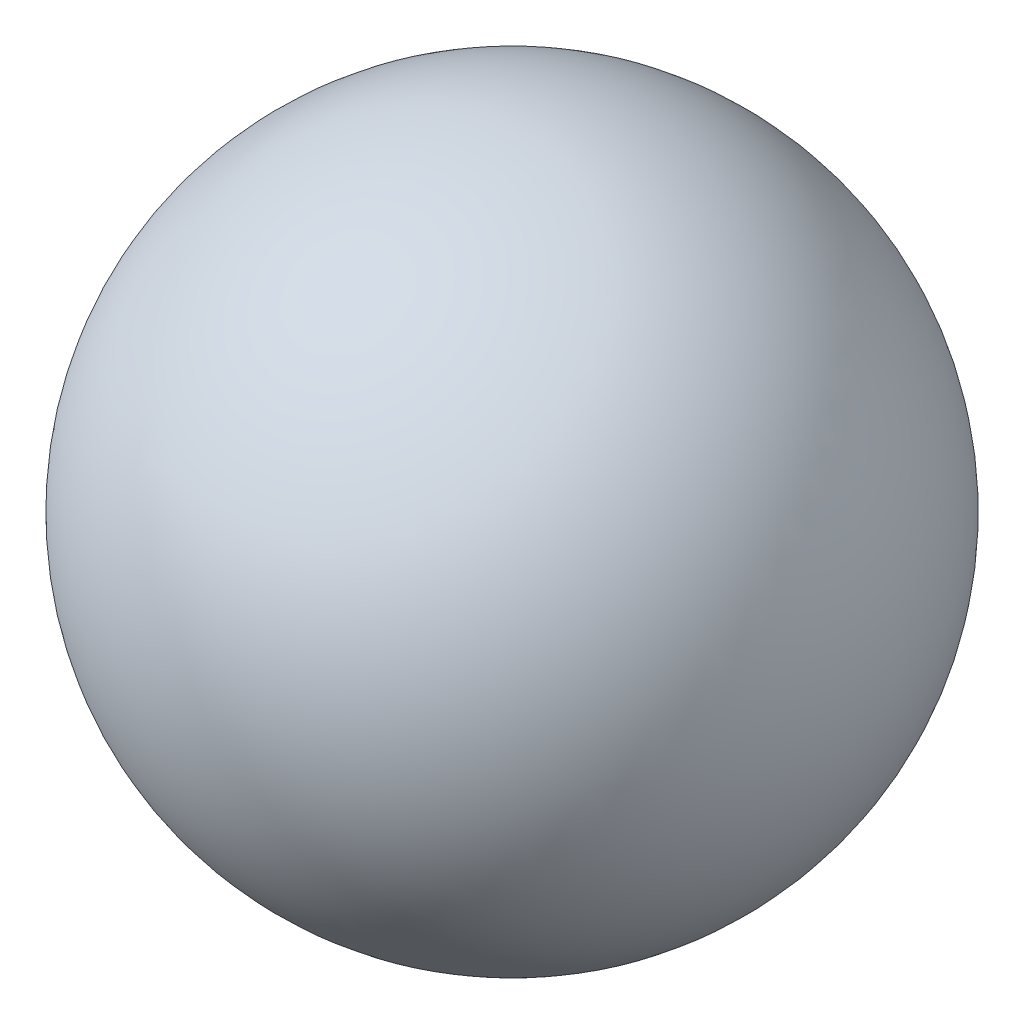
from build123d import *

# Parameters (mm, degrees)
SKETCH1_R                = 0.508
SKETCH1_R_2              = 0.381
BOSS_EXTRUDE1_DEPTH      = 0.127
SKETCH1_4_R              = 0.669887952
BOSS_EXTRUDE3_DEPTH      = 2.54
BOSS_EXTRUDE4_DEPTH      = 2.54
BOSS_EXTRUDE4_DEPTH_BACK = 2.54
SKETCH2_R                = 1.016
SKETCH2_R_2              = 0.508
CUT_EXTRUDE6_START       = 0.5334
SKETCH1_9_R              = 0.381
CUT_EXTRUDE6_DEPTH       = 2.54
SKETCH1_12_R             = 0.381
CUT_EXTRUDE8_DEPTH       = 2.032


with BuildPart() as part:
    # Sketch1 → Boss-Extrude1 (new body)
    with BuildSketch(Plane.XY):
        Circle(SKETCH1_R)
        Circle(SKETCH1_R_2, mode=Mode.SUBTRACT)
    extrude(amount=BOSS_EXTRUDE1_DEPTH)

    # Sketch1<4> → Boss-Extrude3 (add)
    with BuildSketch(Plane.XY):
        Circle(SKETCH1_4_R)
    extrude(amount=-BOSS_EXTRUDE3_DEPTH)

    # Sketch2 → Boss-Extrude4 (add, two sides: drawn at the far end of the back side and taken through both)
    with BuildSketch(Plane(origin=(0, 0, 0), x_dir=(1, 0, 0), z_dir=(0, 1, 0)).offset(-BOSS_EXTRUDE4_DEPTH_BACK)):
        with Locations((0, -0.762)):
            Circle(SKETCH2_R)
        with Locations((0, -0.762)):
            Circle(SKETCH2_R_2, mode=Mode.SUBTRACT)
    extrude(amount=BOSS_EXTRUDE4_DEPTH + BOSS_EXTRUDE4_DEPTH_BACK)

    # Sketch1<9> → Cut-Extrude6 (cut)
    with BuildSketch(Plane.XY.offset(CUT_EXTRUDE6_START)):
        Circle(SKETCH1_9_R)
    extrude(amount=-CUT_EXTRUDE6_DEPTH, mode=Mode.SUBTRACT)

    # Sketch1<12> → Cut-Extrude8 (cut)
    with BuildSketch(Plane.XY):
        Circle(SKETCH1_12_R)
    extrude(amount=-CUT_EXTRUDE8_DEPTH, mode=Mode.SUBTRACT)


with BuildPart() as body_2:
    # Sketch4 → Revolve1 (revolve)
    with BuildSketch(Plane(origin=(0, 0, 0), x_dir=(0, 0, -1), z_dir=(1, 0, 0))):
        with BuildLine():
            ThreePointArc((0, 7.62), (-7.62, 0), (0, -7.62))
            Line((0, -7.62), (0, -7.112))
            ThreePointArc((0, -7.112), (-7.112, 0), (0, 7.112))
            Line((0, 7.112), (0, 7.62))
        make_face()
    revolve(axis=Axis((0, -7.62, 0), (0, 1, 0)))


solid = Compound([part.part, body_2.part])
